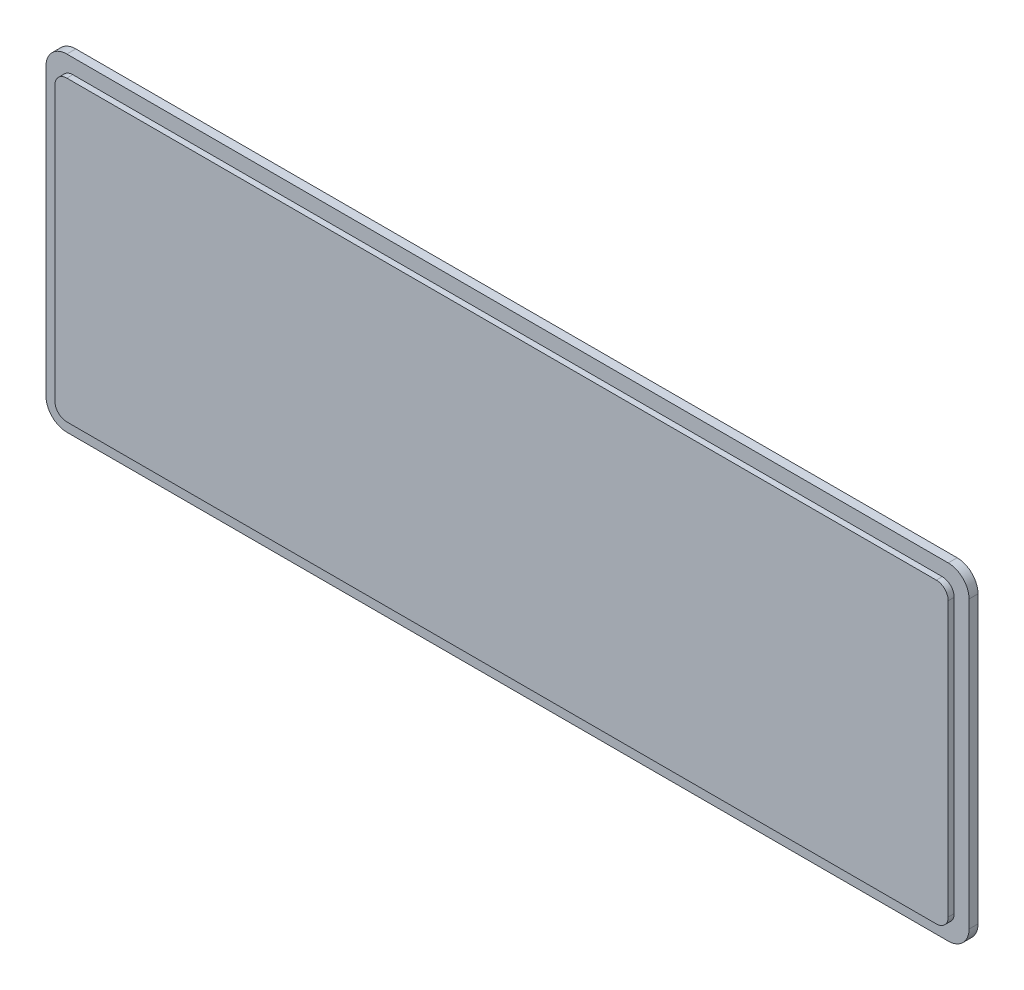
from build123d import *

# Parameters (mm, degrees)
SKETCH_1_W      = 155
SKETCH_1_H      = 55
EXTRUDE_1_DEPTH = 1.5
FILLET_1_R      = 3.5
SKETCH_2_W      = 150
SKETCH_2_H      = 50
EXTRUDE_2_DEPTH = 1
FILLET_3_R      = 2


with BuildPart() as part:
    # 草图1 → 凸台-拉伸1 (new body)
    with BuildSketch(Plane.XY):
        with Locations((77.5, -27.5)):
            Rectangle(SKETCH_1_W, SKETCH_1_H)
    extrude(amount=EXTRUDE_1_DEPTH)

    # 圆角1
    fillet_1_edges = [part.edges().sort_by_distance(p)[0] for p in [
        (0, 0, 0.75),
        (155, 0, 0.75),
        (155, -55, 0.75),
        (0, -55, 0.75),
    ]]
    fillet(fillet_1_edges, radius=FILLET_1_R)

    # 草图2 → 凸台-拉伸2 (add)
    with BuildSketch(Plane.XY.offset(1.5)):
        with Locations((77.5, -27.5)):
            Rectangle(SKETCH_2_W, SKETCH_2_H)
    extrude(amount=EXTRUDE_2_DEPTH)

    # 圆角3
    fillet_3_edges = [part.edges().sort_by_distance(p)[0] for p in [
        (2.5, -2.5, 2),
        (2.5, -52.5, 2),
        (152.5, -52.5, 2),
        (152.5, -2.5, 2),
    ]]
    fillet(fillet_3_edges, radius=FILLET_3_R)


solid = part.part
